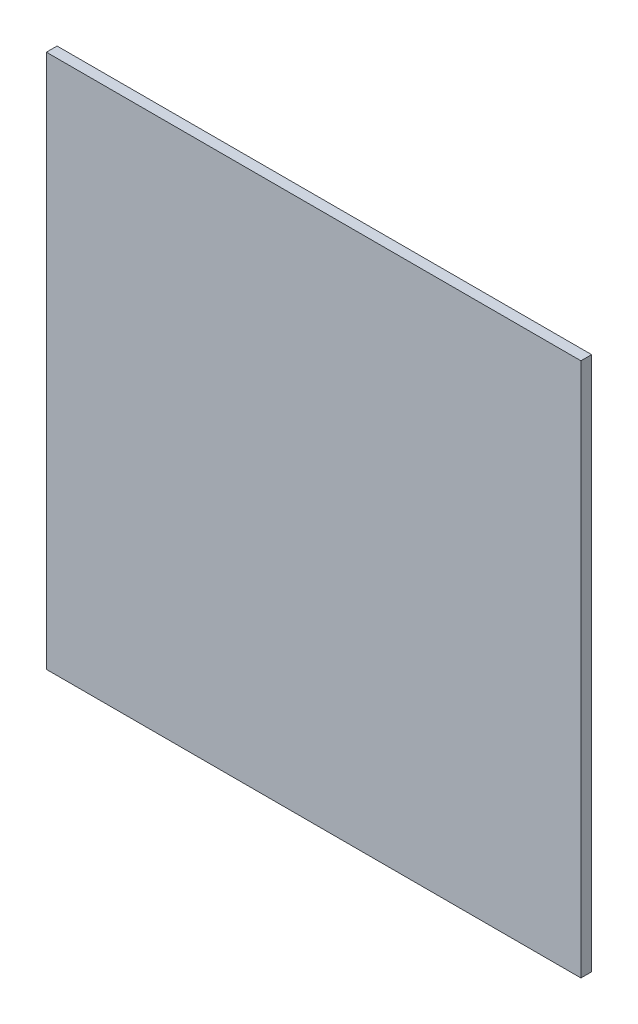
from build123d import *

# Parameters (mm, degrees)
ESQUISSE1_W        = 500
ESQUISSE1_H        = 500
BOSS_EXTRU_1_DEPTH = 10


with BuildPart() as part:
    # Esquisse1 → Boss.-Extru.1 (new body)
    with BuildSketch(Plane.XY):
        Rectangle(ESQUISSE1_W, ESQUISSE1_H)
    extrude(amount=BOSS_EXTRU_1_DEPTH)


solid = part.part
